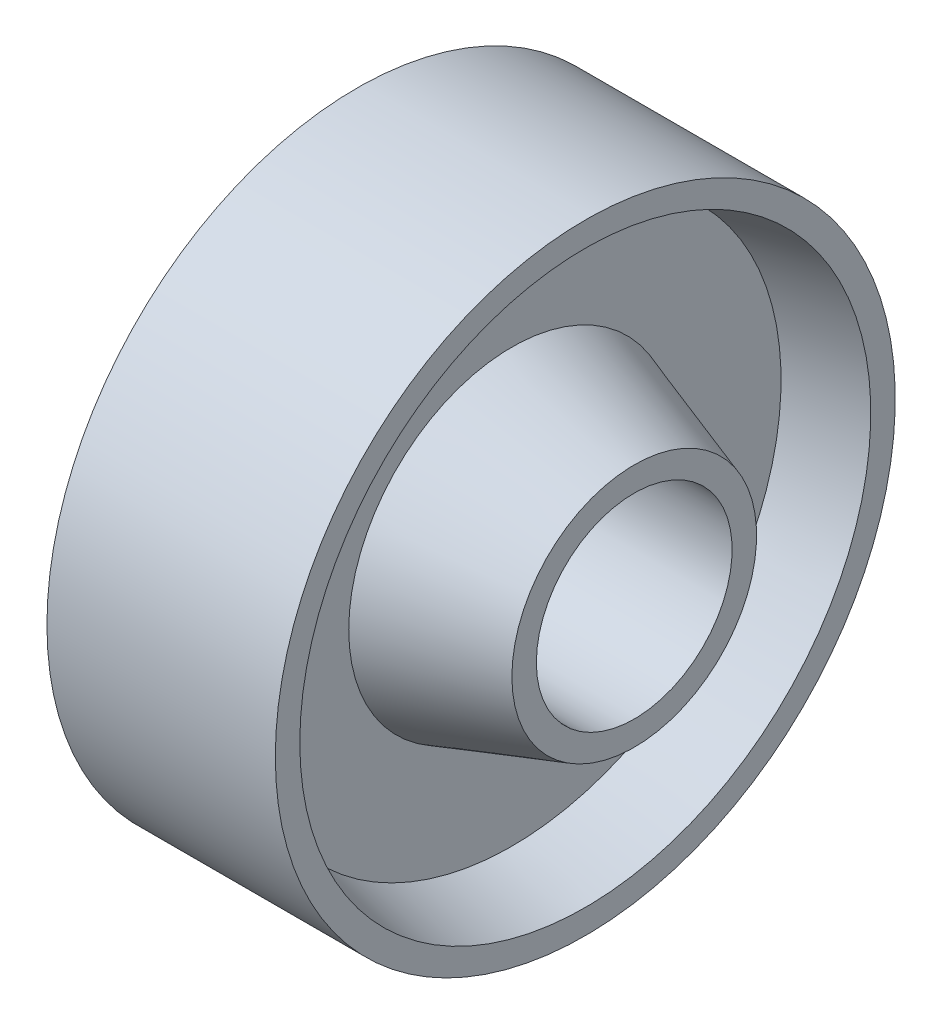
from build123d import *


with BuildPart() as part:
    # Sketch4 → Revolve10 (revolve)
    with BuildSketch(Plane.XY, mode=Mode.PRIVATE) as revolve10_sk:
        Polygon((0, 0), (20, 0), (20, 3), (5, 8), (5, 21), (14, 23), (14, 26), (0, 26), (-14, 26), (-14, 23), (-5, 21), (-5, 8), (-20, 3), (-20, 0), align=None)
    revolve(revolve10_sk.sketch.rotate(Axis((-20, -12, 0), (1, 0, 0)), 90), axis=Axis((-20, -12, 0), (1, 0, 0)))


solid = part.part
